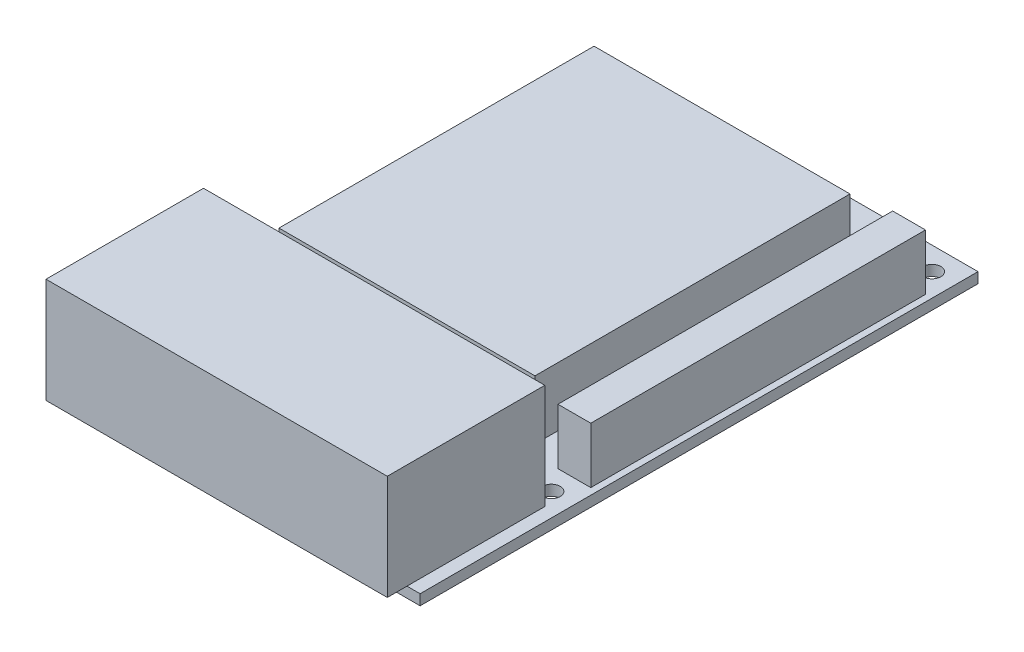
from build123d import *

# Parameters (mm, degrees)
SK_BOARD_W              = 56
SK_BOARD_H              = 85
EX_BOARD_DEPTH          = 1.6
SK_MOUNTHOLES_4X_R      = 1.35
CUT_MOUNTHOLES_4X_DEPTH = 1.6
SK_PORTS_USB_ETH_W      = 52
SK_PORTS_USB_ETH_H      = 24
EX_PORTS_USB_ETH_DEPTH  = 16
SK_ACTIVECOOLER_W       = 39
SK_ACTIVECOOLER_H       = 48
EX_ACTIVECOOLER_DEPTH   = 9
SK_GPIO_W               = 5
SK_GPIO_H               = 51
EX_GPIO_DEPTH           = 8.5


with BuildPart() as part:
    # SK_Board → EX_Board (new body)
    with BuildSketch(Plane(origin=(0, 0, 0), x_dir=(1, 0, 0), z_dir=(0, 1, 0))):
        Rectangle(SK_BOARD_W, SK_BOARD_H)
    extrude(amount=EX_BOARD_DEPTH)

    # SK_MountHoles_4x → CUT_MountHoles_4x (cut)
    with BuildSketch(Plane(origin=(0, 0, 0), x_dir=(1, 0, 0), z_dir=(0, 1, 0))):
        with Locations((-24.5, 39)):
            Circle(SK_MOUNTHOLES_4X_R)
        with Locations((24.5, 39)):
            Circle(SK_MOUNTHOLES_4X_R)
        with Locations((-24.5, -19)):
            Circle(SK_MOUNTHOLES_4X_R)
        with Locations((24.5, -19)):
            Circle(SK_MOUNTHOLES_4X_R)
    extrude(amount=CUT_MOUNTHOLES_4X_DEPTH, mode=Mode.SUBTRACT)

    # SK_Ports_USB_ETH → EX_Ports_USB_ETH (add)
    with BuildSketch(Plane(origin=(0, 1.6, 0), x_dir=(1, 0, 0), z_dir=(0, 1, 0))):
        with Locations((0, -33.5)):
            Rectangle(SK_PORTS_USB_ETH_W, SK_PORTS_USB_ETH_H)
    extrude(amount=EX_PORTS_USB_ETH_DEPTH)

    # SK_ActiveCooler → EX_ActiveCooler (add)
    with BuildSketch(Plane(origin=(0, 1.6, 0), x_dir=(1, 0, 0), z_dir=(0, 1, 0))):
        with Locations((-2.5, 10)):
            Rectangle(SK_ACTIVECOOLER_W, SK_ACTIVECOOLER_H)
    extrude(amount=EX_ACTIVECOOLER_DEPTH)

    # SK_GPIO → EX_GPIO (add)
    with BuildSketch(Plane(origin=(0, 1.6, 0), x_dir=(1, 0, 0), z_dir=(0, 1, 0))):
        with Locations((24.5, 10)):
            Rectangle(SK_GPIO_W, SK_GPIO_H)
    extrude(amount=EX_GPIO_DEPTH)


solid = part.part
